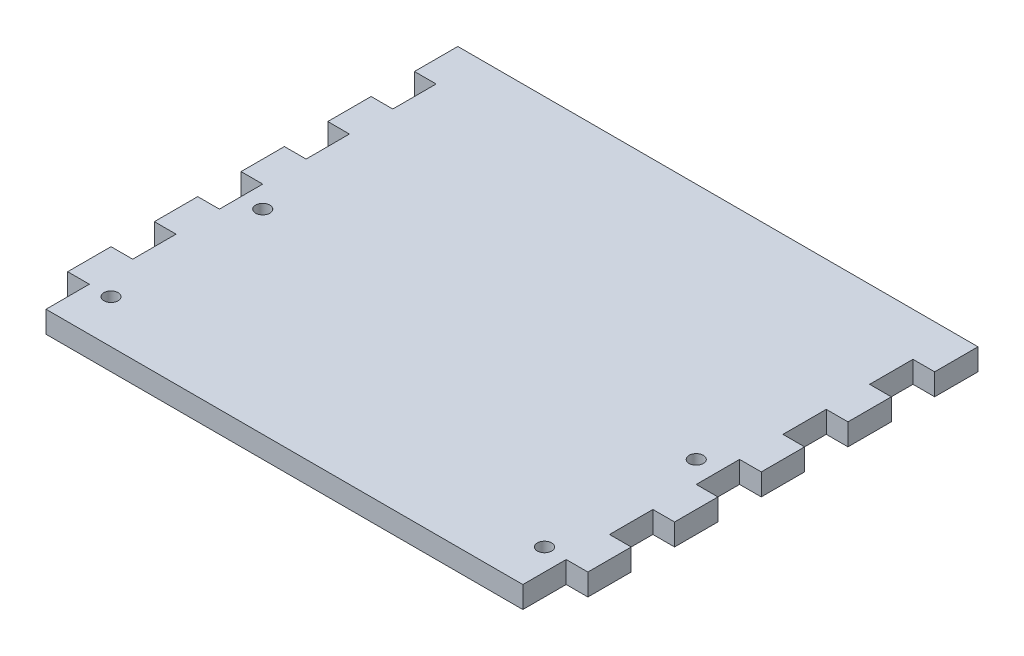
from build123d import *

# Parameters (mm, degrees)
SKETCH2_R           = 2.0828
BOSS_EXTRUDE1_DEPTH = 6.35


with BuildPart() as part:
    # Sketch2 → Boss-Extrude1 (new body)
    with BuildSketch(Plane(origin=(0, 0, 0), x_dir=(1, 0, 0), z_dir=(0, 1, 0))):
        Polygon((3.175, 0), (3.175, 12.7), (-3.175, 12.7), (-3.175, 25.4), (3.175, 25.4), (3.175, 38.1), (-3.175, 38.1), (-3.175, 50.8), (3.175, 50.8), (3.175, 63.5), (-3.175, 63.5), (-3.175, 76.2), (3.175, 76.2), (3.175, 88.9), (-3.175, 88.9), (-3.175, 101.6), (3.175, 101.6), (3.175, 114.3), (-3.175, 114.3), (-3.175, 127), (3.175, 127), (142.875, 127), (149.225, 127), (149.225, 114.3), (142.875, 114.3), (142.875, 101.6), (149.225, 101.6), (149.225, 88.9), (142.875, 88.9), (142.875, 76.2), (149.225, 76.2), (149.225, 63.5), (142.875, 63.5), (142.875, 50.8), (149.225, 50.8), (149.225, 38.1), (142.875, 38.1), (142.875, 25.4), (149.225, 25.4), (149.225, 12.7), (142.875, 12.7), (142.875, 0), align=None)
        with Locations(Location((136.525, 57.15, 0), (0, 0, 90))):
            Circle(SKETCH2_R, mode=Mode.SUBTRACT)
        with Locations(Location((9.525, 12.7, 0), (0, 0, 270))):
            Circle(SKETCH2_R, mode=Mode.SUBTRACT)
        with Locations(Location((9.525, 57.15, 0), (0, 0, 270))):
            Circle(SKETCH2_R, mode=Mode.SUBTRACT)
        with Locations(Location((136.525, 12.7, 0), (0, 0, 90))):
            Circle(SKETCH2_R, mode=Mode.SUBTRACT)
    extrude(amount=BOSS_EXTRUDE1_DEPTH)


solid = part.part
